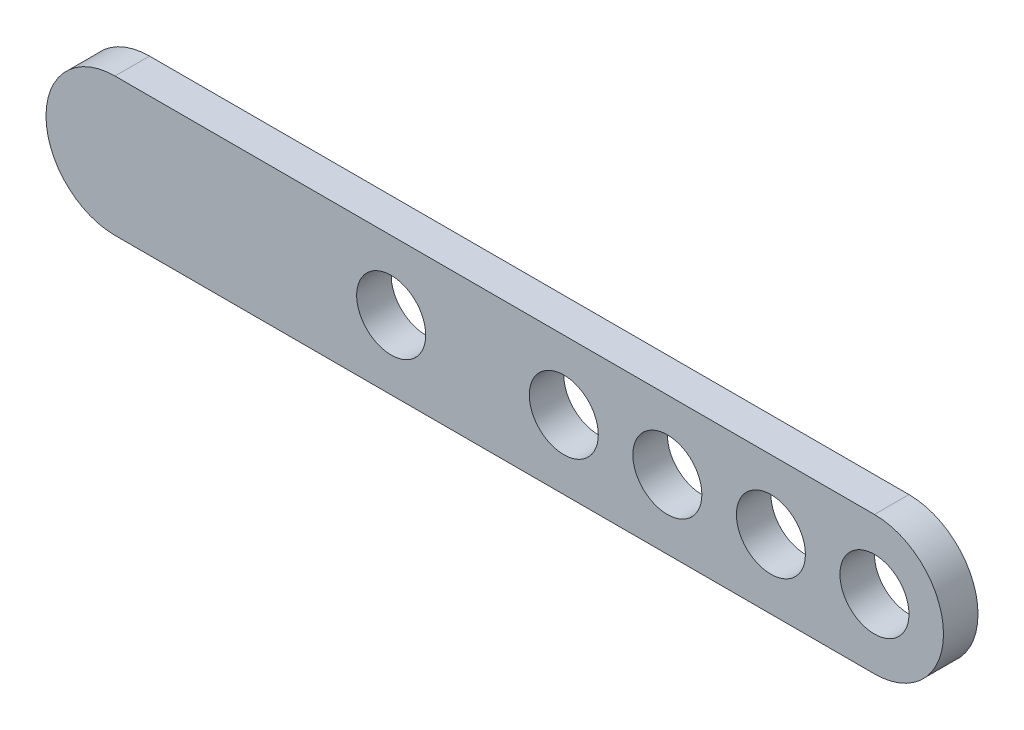
from build123d import *

# Parameters (mm, degrees)
SKETCH1_R           = 12.7
BOSS_EXTRUDE1_DEPTH = 12.7


with BuildPart() as part:
    # Sketch1 → Boss-Extrude1 (new body)
    with BuildSketch(Plane.XY):
        with BuildLine():
            Line((-88.9, 25.4), (88.9, 25.4))
            ThreePointArc((88.9, 25.4), (114.3, 0), (88.9, -25.4))
            Line((88.9, -25.4), (-88.9, -25.4))
            Line((-88.9, -25.4), (-190.5, -25.4))
            ThreePointArc((-190.5, -25.4), (-215.9, 0), (-190.5, 25.4))
            Line((-190.5, 25.4), (-88.9, 25.4))
        make_face()
        with Locations((-88.9, 0)):
            Circle(SKETCH1_R, mode=Mode.SUBTRACT)
        with Locations((88.9, 0)):
            Circle(SKETCH1_R, mode=Mode.SUBTRACT)
        with Locations((50.8, 0)):
            Circle(SKETCH1_R, mode=Mode.SUBTRACT)
        with Locations((12.7, 0)):
            Circle(SKETCH1_R, mode=Mode.SUBTRACT)
        with Locations((-25.4, 0)):
            Circle(SKETCH1_R, mode=Mode.SUBTRACT)
    extrude(amount=BOSS_EXTRUDE1_DEPTH)


solid = part.part
